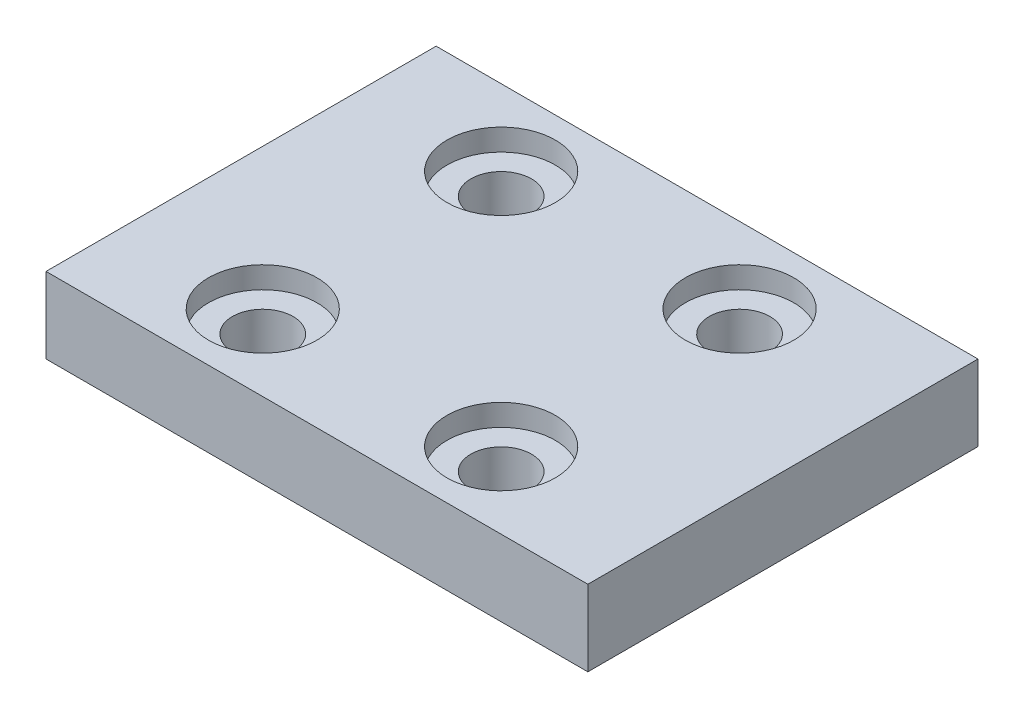
from build123d import *

# Parameters (mm, degrees)
SKETCH1_W           = 50
SKETCH1_H           = 36
BOSS_EXTRUDE1_DEPTH = 7
SKETCH2_R           = 2.8
CUT_EXTRUDE1_DEPTH  = 63.008063992
SKETCH3_R           = 5
CUT_EXTRUDE2_DEPTH  = 2


with BuildPart() as part:
    # Sketch1 → Boss-Extrude1 (new body)
    with BuildSketch(Plane(origin=(0, 0, 0), x_dir=(1, 0, 0), z_dir=(0, 1, 0))):
        with Locations((25, 18)):
            Rectangle(SKETCH1_W, SKETCH1_H)
    extrude(amount=BOSS_EXTRUDE1_DEPTH)

    # Sketch2 → Cut-Extrude1 (cut, through all)
    with BuildSketch(Plane(origin=(0, 7, 0), x_dir=(1, 0, 0), z_dir=(0, 1, 0))):
        with Locations(Location((13, 29, 0), (0, 0, 270))):
            Circle(SKETCH2_R)
        with Locations(Location((13, 7, 0), (0, 0, 90))):
            Circle(SKETCH2_R)
        with Locations(Location((35, 29, 0), (0, 0, 270))):
            Circle(SKETCH2_R)
        with Locations(Location((35, 7, 0), (0, 0, 270))):
            Circle(SKETCH2_R)
    extrude(amount=-CUT_EXTRUDE1_DEPTH, mode=Mode.SUBTRACT)

    # Sketch3 → Cut-Extrude2 (cut)
    with BuildSketch(Plane(origin=(0, 7, 0), x_dir=(1, 0, 0), z_dir=(0, 1, 0))):
        with Locations(Location((13, 29, 0), (0, 0, 270))):
            Circle(SKETCH3_R)
        with Locations(Location((13, 7, 0), (0, 0, 270))):
            Circle(SKETCH3_R)
        with Locations(Location((35, 29, 0), (0, 0, 270))):
            Circle(SKETCH3_R)
        with Locations(Location((35, 7, 0), (0, 0, 270))):
            Circle(SKETCH3_R)
    extrude(amount=-CUT_EXTRUDE2_DEPTH, mode=Mode.SUBTRACT)


solid = part.part
